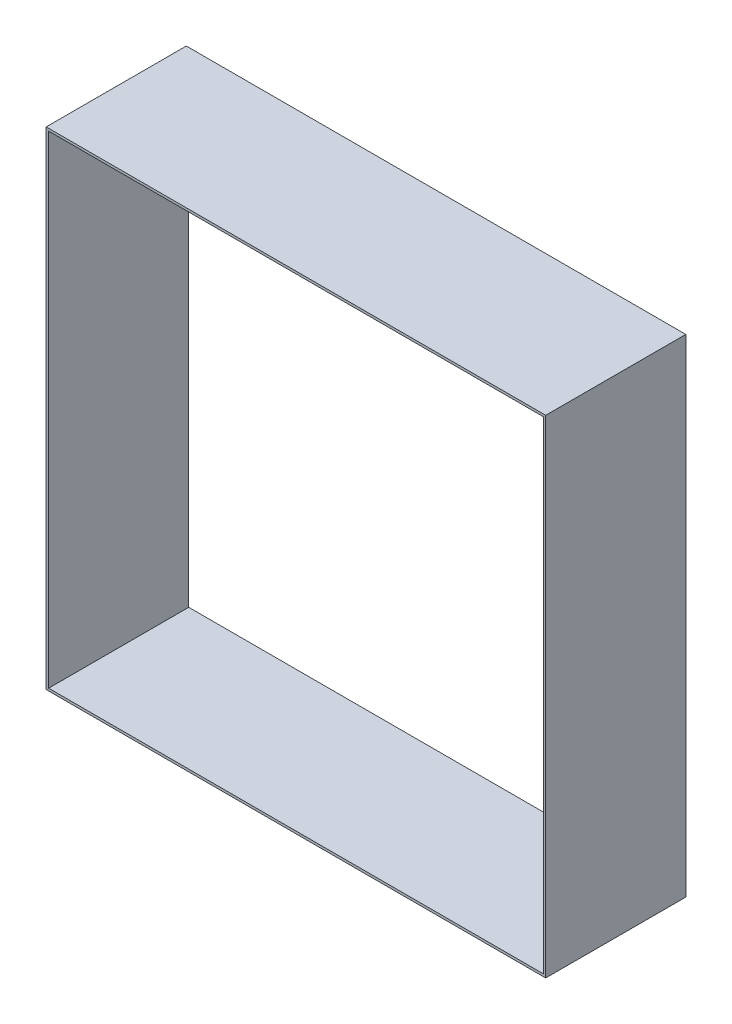
from build123d import *

# Parameters (mm, degrees)
SKETCH_1_W      = 41
SKETCH_1_H      = 40
SKETCH_1_W_2    = 40.6
SKETCH_1_H_2    = 39.6
EXTRUDE_1_DEPTH = 11.5


with BuildPart() as part:
    # 스케치1 → 보스-돌출1 (new body)
    with BuildSketch(Plane.XY):
        with Locations((20.5, 20)):
            Rectangle(SKETCH_1_W, SKETCH_1_H)
        with Locations((20.5, 20)):
            Rectangle(SKETCH_1_W_2, SKETCH_1_H_2, mode=Mode.SUBTRACT)
    extrude(amount=EXTRUDE_1_DEPTH)


solid = part.part
